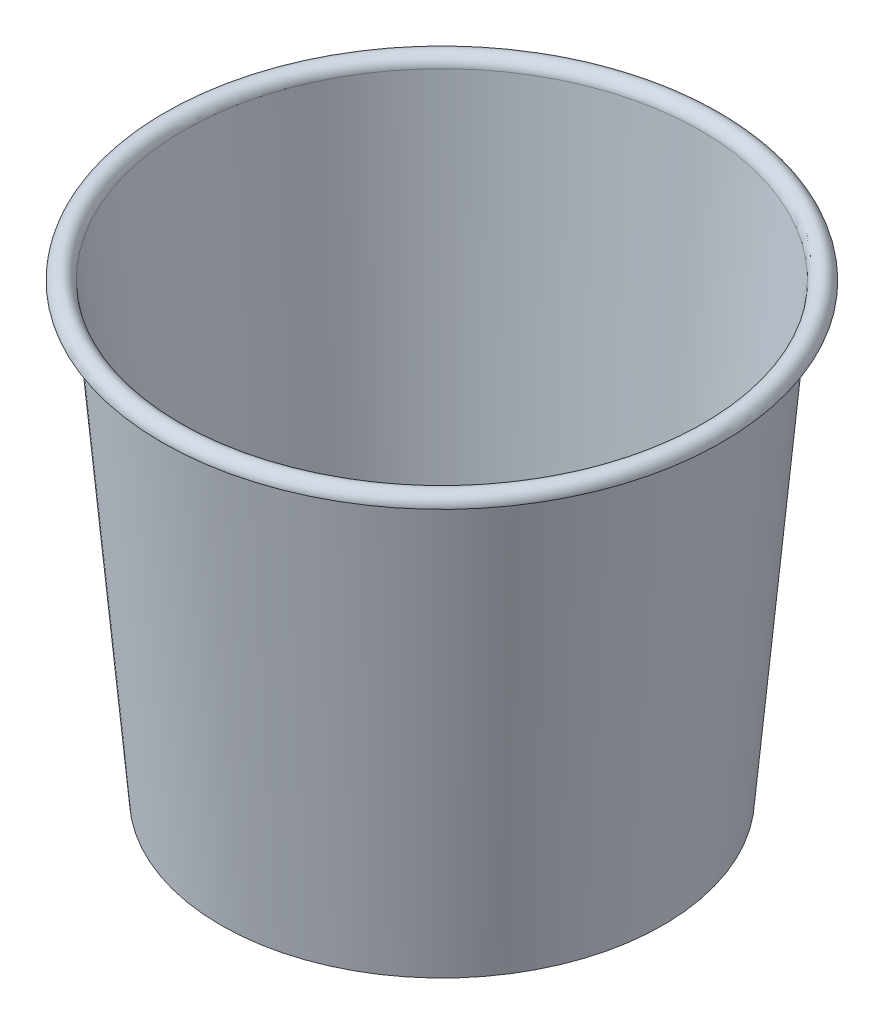
from build123d import *


with BuildPart() as part:
    # ｽｹｯﾁ1 → 回転1 (revolve)
    with BuildSketch(Plane.XY, mode=Mode.PRIVATE) as revolve_1_sk:
        with BuildLine():
            Line((0, 0), (124.020829918, 0))
            Line((124.020829918, 0), (146.01902651, 251.440537606))
            ThreePointArc((146.01902651, 251.440537606), (151.218096937, 256), (156, 251.004758892))
            Line((156, 251.004758892), (157, 251.004758892))
            ThreePointArc((157, 251.004758892), (151.261716324, 256.999048222), (145.022831811, 251.527693349))
            Line((145.022831811, 251.527693349), (123.104498744, 1))
            Line((123.104498744, 1), (0, 1))
            Line((0, 1), (0, 0))
        make_face()
    revolve(revolve_1_sk.sketch.rotate(Axis((0, 1, 0), (0, -1, 0)), 90), axis=Axis((0, 1, 0), (0, -1, 0)))


solid = part.part
